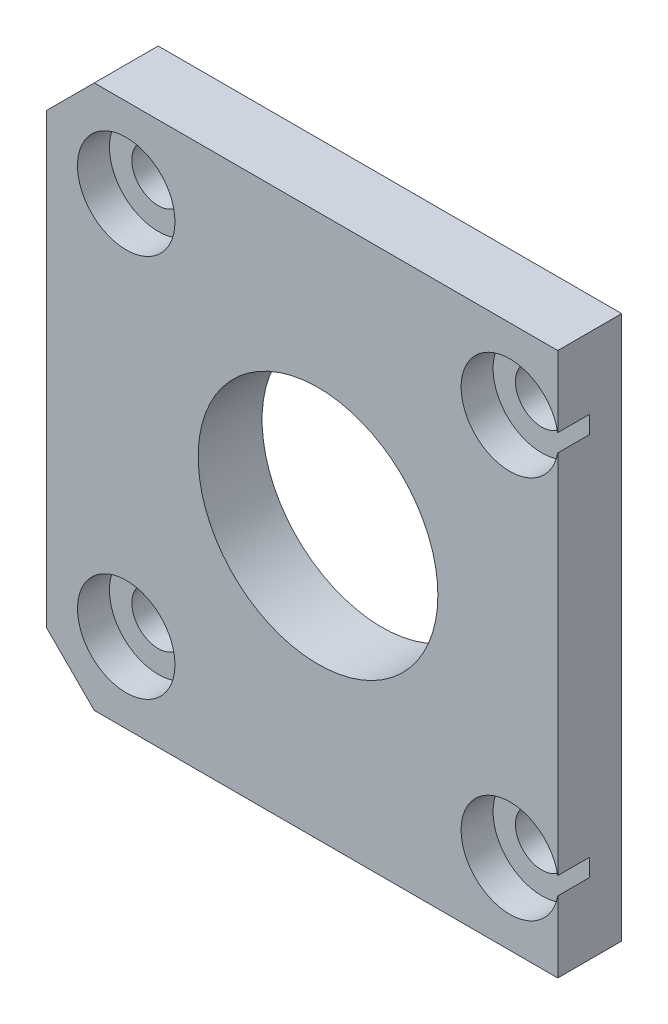
from build123d import *

# Parameters (mm, degrees)
SKETCH_1_R          = 7.5
SKETCH_1_R_2        = 1.65
EXTRUDE_1_DEPTH     = 4
SKETCH_2_R          = 3.05
CUT_EXTRUDE_1_DEPTH = 2


with BuildPart() as part:
    # 草图1 → 凸台-拉伸1 (new body)
    with BuildSketch(Plane.XY):
        Polygon((0, 31), (3, 34), (32, 34), (32, 0), (3, 0), (0, 3), align=None)
        with Locations((17, 17)):
            Circle(SKETCH_1_R, mode=Mode.SUBTRACT)
        with Locations((5, 29)):
            Circle(SKETCH_1_R_2, mode=Mode.SUBTRACT)
        with Locations((29, 29)):
            Circle(SKETCH_1_R_2, mode=Mode.SUBTRACT)
        with Locations((5, 5)):
            Circle(SKETCH_1_R_2, mode=Mode.SUBTRACT)
        with Locations((29, 5)):
            Circle(SKETCH_1_R_2, mode=Mode.SUBTRACT)
    extrude(amount=EXTRUDE_1_DEPTH)

    # 草图2 → 切除-拉伸1 (cut)
    with BuildSketch(Plane.XY.offset(4)):
        with Locations((5, 29)):
            Circle(SKETCH_2_R)
        with Locations((29, 29)):
            Circle(SKETCH_2_R)
        with Locations((5, 5)):
            Circle(SKETCH_2_R)
        with Locations((29, 5)):
            Circle(SKETCH_2_R)
    extrude(amount=-CUT_EXTRUDE_1_DEPTH, mode=Mode.SUBTRACT)


solid = part.part
